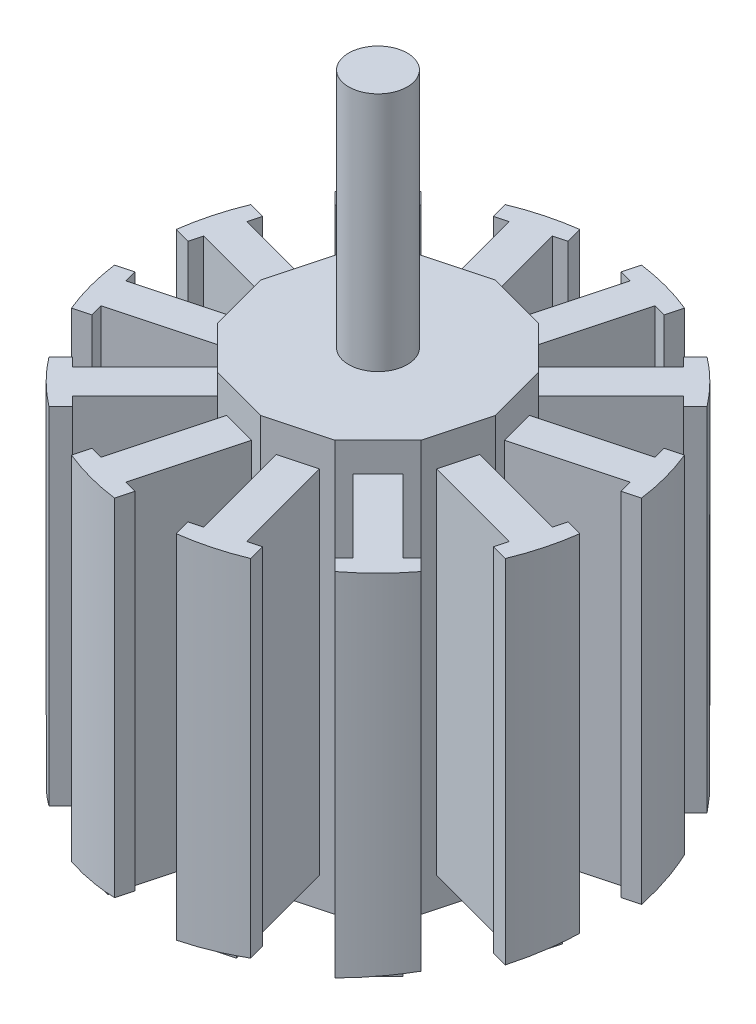
from build123d import *

# Parameters (mm, degrees)
SKETCH_1_R               = 1
EXTRUDE_1_DEPTH          = 20
EXTRUDE_START            = -8.2
EXTRUDE_3_DEPTH          = 14
SKETCH_6_W               = 1.2
SKETCH_6_H               = 12
EXTRUDE_4_DEPTH          = 4
EXTRUDE_START_2          = -0.5
EXTRUDE_5_DEPTH          = 1.5
PATTERN_CIRCULAR_1_COUNT = 12
SKETCH_12_OUTSIDE_W      = 26.342
SKETCH_12_OUTSIDE_H      = 26.342
SKETCH_12_OUTSIDE_R      = 8
CUT_EXTRUDE_2_DEPTH      = 19.759656212


with BuildPart() as part:
    # 草图1 → 凸台-拉伸1 (new body)
    with BuildSketch(Plane(origin=(0, 0, 0), x_dir=(1, 0, 0), z_dir=(0, 1, 0))):
        with Locations(Location((0, 0, 0), (0, 0, 270))):
            Circle(SKETCH_1_R)
    extrude(amount=EXTRUDE_1_DEPTH)

    # 草图4 → 凸台-拉伸3 (add)
    with BuildSketch(Plane(origin=(0, 20, 0), x_dir=(1, 0, 0), z_dir=(0, 1, 0)).offset(EXTRUDE_START)):
        Polygon((4, 0), (3.464101615, 2), (2, 3.464101615), (0, 4), (-2, 3.464101615), (-3.464101615, 2), (-4, 0), (-3.464101615, -2), (-2, -3.464101615), (0, -4), (2, -3.464101615), (3.464101615, -2), align=None)
    extrude(amount=-EXTRUDE_3_DEPTH)

    # 草图6 → 凸台-拉伸4 (add)
    with BuildSketch(Plane(origin=(-3.732050808, 0, -1), x_dir=(-0.258819045102507, 0, 0.9659258262890721), z_dir=(-0.9659258262890721, 0, -0.258819045102507))):
        with Locations((0, 4.8)):
            Rectangle(SKETCH_6_W, SKETCH_6_H)
    extrude_4 = extrude(amount=EXTRUDE_4_DEPTH)

    # 草图7 → 凸台-拉伸5 (add)
    with BuildSketch(Plane(origin=(-7.595754113, 0, -2.03527618), x_dir=(-0.25881904510250703, 0, 0.9659258262890721), z_dir=(-0.9659258262890721, 0, -0.25881904510250703)).offset(EXTRUDE_START_2)):
        Polygon((1.03527618, 10.8), (-1.03527618, 10.8), (-1.03527618, -1.2), (1.03527618, -1), align=None)
    extrude_5 = extrude(amount=EXTRUDE_5_DEPTH)

    # 阵列(圆周)1: 凸台-拉伸4, 凸台-拉伸5 ×12 about axis
    pattern_circular_1_axis = Axis((0, 0, 0), (0, 1, 0))
    add([extrude_4.rotate(pattern_circular_1_axis, i * 360 / PATTERN_CIRCULAR_1_COUNT) for i in range(1, PATTERN_CIRCULAR_1_COUNT)])
    add([extrude_5.rotate(pattern_circular_1_axis, i * 360 / PATTERN_CIRCULAR_1_COUNT) for i in range(1, PATTERN_CIRCULAR_1_COUNT)])

    # 草图12 outside → 切除-拉伸2 (cut, through all)
    with BuildSketch(Plane(origin=(0, 11.8, 0), x_dir=(1, 0, 0), z_dir=(0, 1, 0))):
        Rectangle(SKETCH_12_OUTSIDE_W, SKETCH_12_OUTSIDE_H)
        Circle(SKETCH_12_OUTSIDE_R, mode=Mode.SUBTRACT)
    extrude(amount=-CUT_EXTRUDE_2_DEPTH, mode=Mode.SUBTRACT)


solid = part.part
